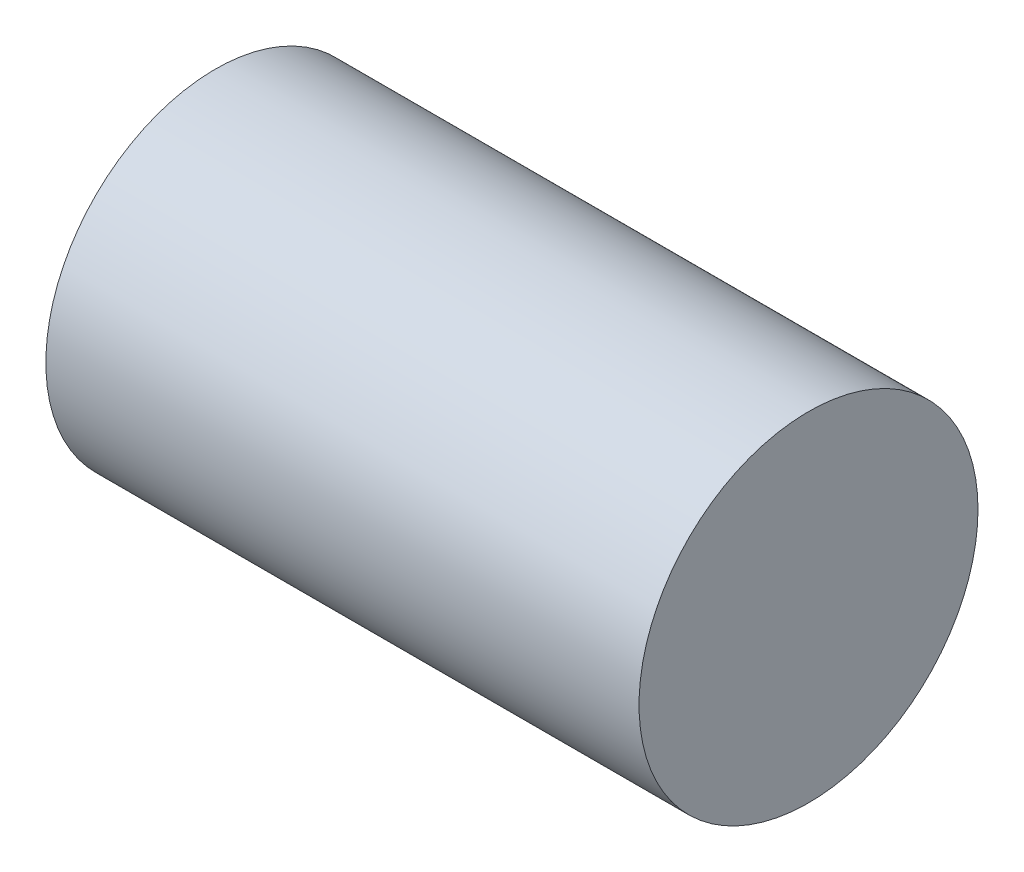
from build123d import *

# Parameters (mm, degrees)
SKETCH1_R           = 200
BOSS_EXTRUDE1_DEPTH = 700


with BuildPart() as part:
    # Sketch1 → Boss-Extrude1 (new body)
    with BuildSketch(Plane(origin=(0, 0, 0), x_dir=(0, 0, -1), z_dir=(1, 0, 0))):
        Circle(SKETCH1_R)
    extrude(amount=BOSS_EXTRUDE1_DEPTH)


solid = part.part
